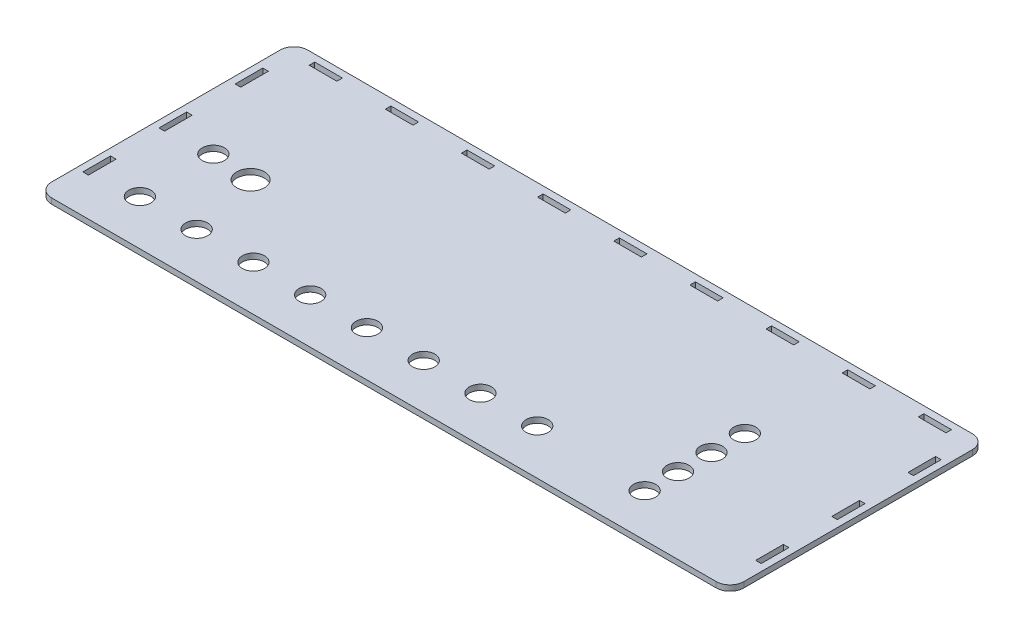
from build123d import *

# Parameters (mm, degrees)
SKETCH2_W                    = 500
SKETCH2_H                    = 185
BASE_DEPTH                   = 4
SKETCH3_W                    = 20
SKETCH3_H                    = 4
TOP_HOLE_DEFINITION_DEPTH    = 267.593792126
TOP_HOLE_PATTERN_COUNT       = 5
TOP_HOLE_PATTERN_PITCH       = 55
TOP_HOLE_PATTERN_COUNT_DIR2  = 5
TOP_HOLE_PATTERN_PITCH_DIR2  = 55
SKETCH4_W                    = 4
SKETCH4_H                    = 20
LEFT_HOLE_DEFINITION_DEPTH   = 267.593792126
LEFT_HOLE_PATTERN_COUNT      = 2
LEFT_HOLE_PATTERN_PITCH      = 55
LEFT_HOLE_PATTERN_COUNT_DIR2 = 2
LEFT_HOLE_PATTERN_PITCH_DIR2 = 55
FILLET1_R                    = 10
MIRROR2_COPY_1_SKETCH_W      = 4
MIRROR2_COPY_1_SKETCH_H      = 20
MIRROR2_COPY_1_DEPTH         = 267.593792126
MIRROR2_COPY_2_SKETCH_W      = 4
MIRROR2_COPY_2_SKETCH_H      = 20
MIRROR2_COPY_2_DEPTH         = 267.593792126
MIRROR2_COPY_3_SKETCH_W      = 4
MIRROR2_COPY_3_SKETCH_H      = 20
MIRROR2_COPY_3_DEPTH         = 267.593792126
SKETCH7_R                    = 8
SKETCH7_R_2                  = 10
CUT_EXTRUDE5_DEPTH           = 267.593792126


with BuildPart() as part:
    # Sketch2 → Base (new body)
    with BuildSketch(Plane(origin=(0, 0, 0), x_dir=(1, 0, 0), z_dir=(0, 1, 0))):
        Rectangle(SKETCH2_W, SKETCH2_H)
    extrude(amount=BASE_DEPTH)

    # Sketch3 → Top Hole Definition (cut, through all)
    with BuildSketch(Plane(origin=(0, 4, 0), x_dir=(1, 0, 0), z_dir=(0, 1, 0))):
        with Locations((0, 85.5)):
            Rectangle(SKETCH3_W, SKETCH3_H)
    top_hole_definition = extrude(amount=-TOP_HOLE_DEFINITION_DEPTH, mode=Mode.SUBTRACT)

    # Top Hole Pattern: Top Hole Definition 5 × 5
    with Locations(*[Vector(-1, 0, 0) * (i * TOP_HOLE_PATTERN_PITCH) + Vector(1, 0, 0) * (j * TOP_HOLE_PATTERN_PITCH_DIR2) for i in range(TOP_HOLE_PATTERN_COUNT) for j in range(TOP_HOLE_PATTERN_COUNT_DIR2) if (i, j) != (0, 0)]):
        add(top_hole_definition, mode=Mode.SUBTRACT)

    # Sketch4 → Left Hole Definition (cut, through all)
    with BuildSketch(Plane(origin=(0, 4, 0), x_dir=(1, 0, 0), z_dir=(0, 1, 0))):
        with Locations((-243, 0)):
            Rectangle(SKETCH4_W, SKETCH4_H)
    left_hole_definition = extrude(amount=-LEFT_HOLE_DEFINITION_DEPTH, mode=Mode.SUBTRACT)

    # Left Hole Pattern: Left Hole Definition 2 × 2
    with Locations(*[Vector(0, 0, -1) * (i * LEFT_HOLE_PATTERN_PITCH) + Vector(0, 0, 1) * (j * LEFT_HOLE_PATTERN_PITCH_DIR2) for i in range(LEFT_HOLE_PATTERN_COUNT) for j in range(LEFT_HOLE_PATTERN_COUNT_DIR2) if (i, j) != (0, 0)]):
        add(left_hole_definition, mode=Mode.SUBTRACT)

    # Fillet1
    fillet1_edges = [part.edges().sort_by_distance(p)[0] for p in [
        (250, 2, -92.5),
        (250, 2, 92.5),
        (-250, 2, -92.5),
        (-250, 2, 92.5),
    ]]
    fillet(fillet1_edges, radius=FILLET1_R)

    # Mirror2: Left Hole Definition across plane
    add(left_hole_definition.mirror(Plane(origin=(0, 0, 0), x_dir=(0, 0, 1), z_dir=(1, 0, 0))), mode=Mode.SUBTRACT)

    # Mirror2 copy 1 sketch → Mirror2 copy 1 (cut, through all)
    with BuildSketch(Plane(origin=(0, 4, 55), x_dir=(-1, 0, 0), z_dir=(0, 1, 0))):
        with Locations((-243, 0)):
            Rectangle(MIRROR2_COPY_1_SKETCH_W, MIRROR2_COPY_1_SKETCH_H)
    extrude(amount=-MIRROR2_COPY_1_DEPTH, mode=Mode.SUBTRACT)

    # Mirror2 copy 2 sketch → Mirror2 copy 2 (cut, through all)
    with BuildSketch(Plane(origin=(0, 4, -55), x_dir=(-1, 0, 0), z_dir=(0, 1, 0))):
        with Locations((-243, 0)):
            Rectangle(MIRROR2_COPY_2_SKETCH_W, MIRROR2_COPY_2_SKETCH_H)
    extrude(amount=-MIRROR2_COPY_2_DEPTH, mode=Mode.SUBTRACT)

    # Mirror2 copy 3 sketch → Mirror2 copy 3 (cut, through all)
    with BuildSketch(Plane(origin=(0, 4, 0), x_dir=(-1, 0, 0), z_dir=(0, 1, 0))):
        with Locations((-243, 0)):
            Rectangle(MIRROR2_COPY_3_SKETCH_W, MIRROR2_COPY_3_SKETCH_H)
    extrude(amount=-MIRROR2_COPY_3_DEPTH, mode=Mode.SUBTRACT)

    # Sketch7 → Cut-Extrude5 (cut, through all)
    with BuildSketch(Plane.XZ):
        with Locations((-209, 59.798294078)):
            Circle(SKETCH7_R)
        with Locations((-168, 59.798294078)):
            Circle(SKETCH7_R)
        with Locations((-127, 59.798294078)):
            Circle(SKETCH7_R)
        with Locations((-86, 59.798294078)):
            Circle(SKETCH7_R)
        with Locations((-45, 59.798294078)):
            Circle(SKETCH7_R)
        with Locations((-4, 59.798294078)):
            Circle(SKETCH7_R)
        with Locations((37, 59.798294078)):
            Circle(SKETCH7_R)
        with Locations((78, 59.798294078)):
            Circle(SKETCH7_R)
        with Locations((-179.5, 9.310158007)):
            Circle(SKETCH7_R_2)
        with Locations((-209, 6.747125767)):
            Circle(SKETCH7_R)
        with Locations((157.298294078, 61.5)):
            Circle(SKETCH7_R)
        with Locations((157.431778922, 37.500371215)):
            Circle(SKETCH7_R)
        with Locations((157.565263767, 13.500742431)):
            Circle(SKETCH7_R)
        with Locations((157.698748611, -10.498886354)):
            Circle(SKETCH7_R)
    extrude(amount=-CUT_EXTRUDE5_DEPTH, mode=Mode.SUBTRACT)


solid = part.part
